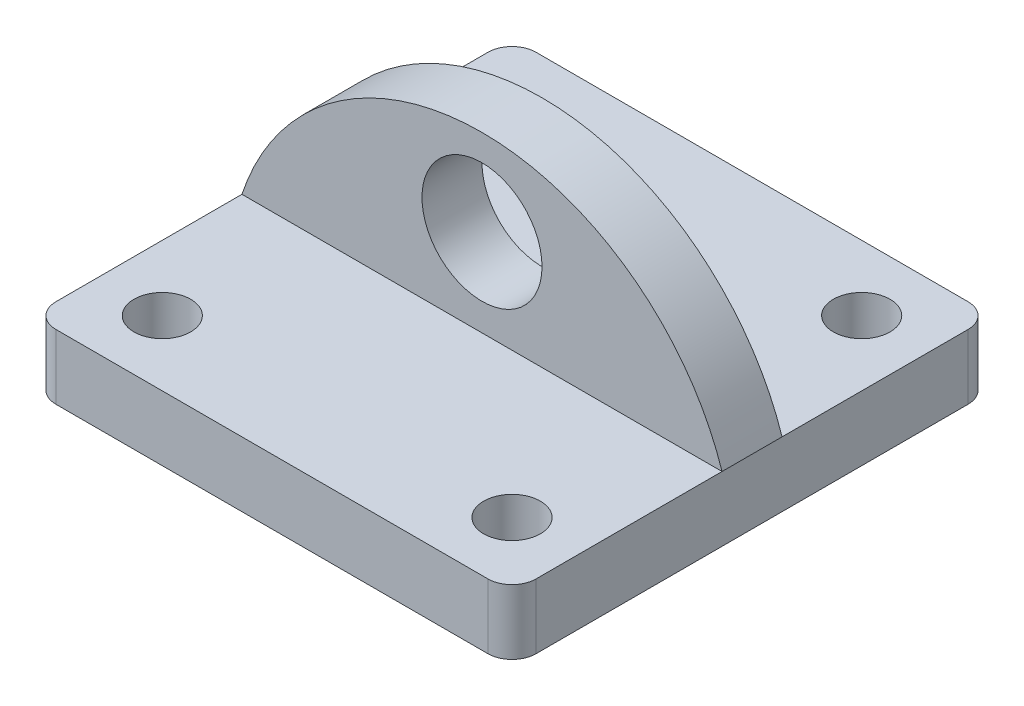
from build123d import *

# Parameters (mm, degrees)
SKETCH1_R           = 2.999994
BOSS_EXTRUDE1_DEPTH = 6.858
SKETCH2_W           = 50.8
SKETCH2_H           = 19.05
BOSS_EXTRUDE2_DEPTH = 24.892
SKETCH3_R           = 6.35
CUT_EXTRUDE1_DEPTH  = 24.892
SKETCH4_W           = 6.35
SKETCH4_H           = 18.373928642
CUT_EXTRUDE2_DEPTH  = 58.166


with BuildPart() as part:
    # Sketch1 → Boss-Extrude1 (new body)
    with BuildSketch(Plane(origin=(0, 0, 0), x_dir=(1, 0, 0), z_dir=(0, 1, 0))):
        with BuildLine():
            Line((22.86, -25.4), (-22.86, -25.4))
            ThreePointArc((-22.86, -25.4), (-24.656051224, -24.656051224), (-25.4, -22.86))
            Line((-25.4, -22.86), (-25.4, 22.86))
            ThreePointArc((-25.4, 22.86), (-24.656051224, 24.656051224), (-22.86, 25.4))
            Line((-22.86, 25.4), (22.86, 25.4))
            ThreePointArc((22.86, 25.4), (24.656051224, 24.656051224), (25.4, 22.86))
            Line((25.4, 22.86), (25.4, -22.86))
            ThreePointArc((25.4, -22.86), (24.656051224, -24.656051224), (22.86, -25.4))
        make_face()
        with Locations((-18.499963, 18.499963)):
            Circle(SKETCH1_R, mode=Mode.SUBTRACT)
        with Locations((18.499963, 18.499963)):
            Circle(SKETCH1_R, mode=Mode.SUBTRACT)
        with Locations((18.499963, -18.499963)):
            Circle(SKETCH1_R, mode=Mode.SUBTRACT)
        with Locations((-18.499963, -18.499963)):
            Circle(SKETCH1_R, mode=Mode.SUBTRACT)
    extrude(amount=BOSS_EXTRUDE1_DEPTH)

    # Sketch2 → Boss-Extrude2 (add)
    with BuildSketch(Plane(origin=(0, 6.858, 0), x_dir=(1, 0, 0), z_dir=(0, 1, 0))):
        Rectangle(SKETCH2_W, SKETCH2_H)
    extrude(amount=BOSS_EXTRUDE2_DEPTH)

    # Sketch3 → Cut-Extrude1 (cut)
    with BuildSketch(Plane.XY.offset(9.525)):
        with BuildLine():
            Line((25.4, 31.75), (-25.4, 31.75))
            Line((-25.4, 31.75), (-25.4, 6.858))
            ThreePointArc((-25.4, 6.858), (0, 25.231928642), (25.4, 6.858))
            Line((25.4, 6.858), (25.4, 31.75))
        make_face()
        with Locations((0, 16.103217479)):
            Circle(SKETCH3_R)
    extrude(amount=-CUT_EXTRUDE1_DEPTH, mode=Mode.SUBTRACT)

    # Sketch4 → Cut-Extrude2 (cut)
    with BuildSketch(Plane.ZY.offset(25.4)):
        with Locations((-6.35, 16.044964321)):
            Rectangle(SKETCH4_W, SKETCH4_H)
        with Locations((6.35, 16.044964321)):
            Rectangle(SKETCH4_W, SKETCH4_H)
    extrude(amount=-CUT_EXTRUDE2_DEPTH, mode=Mode.SUBTRACT)


solid = part.part
